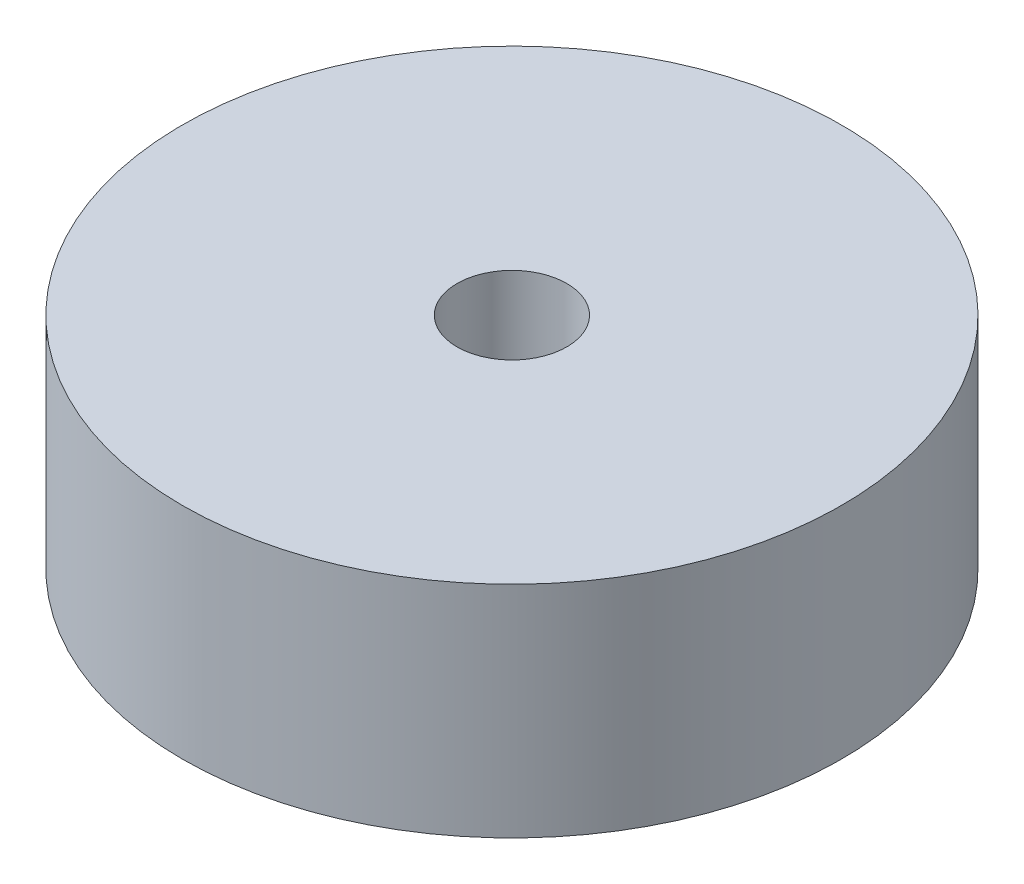
from build123d import *

# Parameters (mm, degrees)
SKETCH1_R           = 19.05
BOSS_EXTRUDE1_DEPTH = 12.7
SKETCH2_R           = 3.175
CUT_EXTRUDE1_DEPTH  = 12.7


with BuildPart() as part:
    # Sketch1 → Boss-Extrude1 (new body)
    with BuildSketch(Plane(origin=(0, 0, 0), x_dir=(1, 0, 0), z_dir=(0, 1, 0))):
        with Locations(Location((0, 0, 0), (0, 0, 270))):
            Circle(SKETCH1_R)
    extrude(amount=BOSS_EXTRUDE1_DEPTH)

    # Sketch2 → Cut-Extrude1 (cut)
    with BuildSketch(Plane(origin=(0, 12.7, 0), x_dir=(1, 0, 0), z_dir=(0, 1, 0))):
        with Locations(Location((0, 0, 0), (0, 0, 270))):
            Circle(SKETCH2_R)
    extrude(amount=-CUT_EXTRUDE1_DEPTH, mode=Mode.SUBTRACT)


solid = part.part
